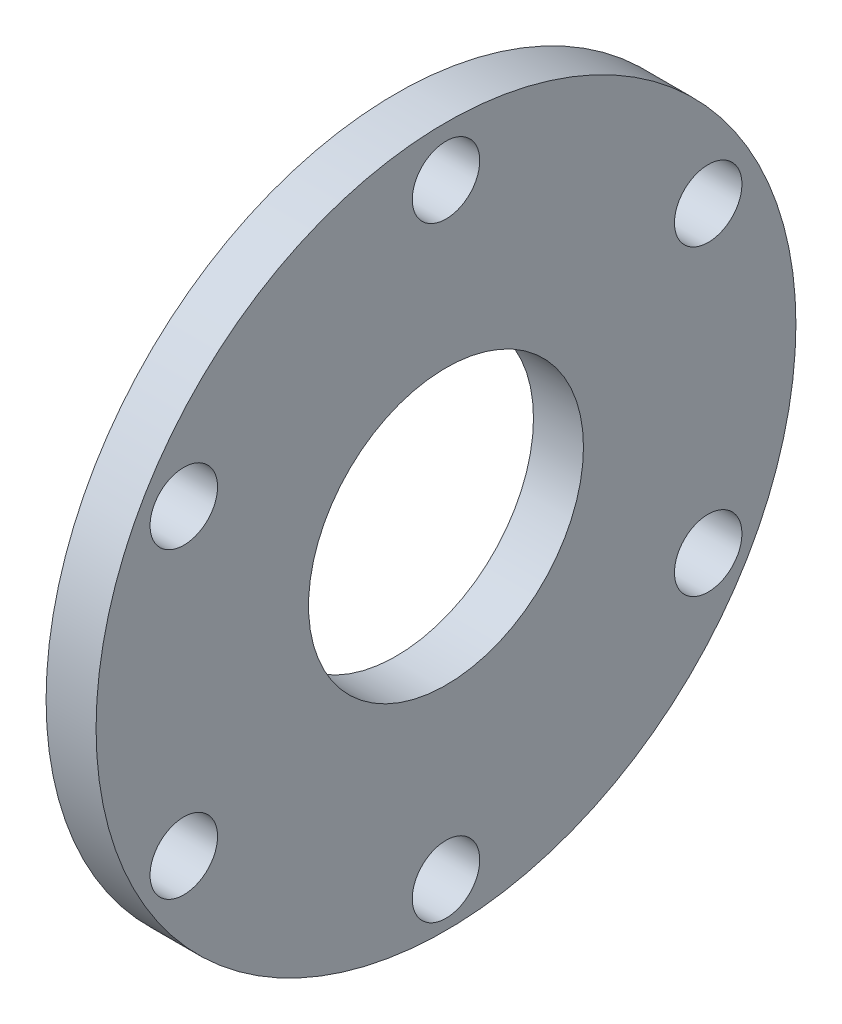
from build123d import *

# Parameters (mm, degrees)
CROQUIS1_R              = 70
SALIENTE_EXTRUIR1_DEPTH = 10
MATRIZC5_COUNT          = 6
CROQUIS9_R              = 27.5
CORTAR_EXTRUIR1_DEPTH   = 10


with BuildPart() as part:
    # Croquis1 → Saliente-Extruir1 (new body)
    with BuildSketch(Plane(origin=(0, 0, 0), x_dir=(0, 0, -1), z_dir=(1, 0, 0))):
        Circle(CROQUIS1_R)
    extrude(amount=SALIENTE_EXTRUIR1_DEPTH)

    # Croquis8 → Taladro de margen para M122 (revolve, cut)
    with BuildSketch(Plane(origin=(10, 60, 0), x_dir=(0, 0, -1), z_dir=(0, 1, 0))):
        Polygon((0, 0), (0, 47.555809178), (6.75, 43.5), (6.75, 0), align=None)
    taladro_de_margen_para_m122 = revolve(axis=Axis((16.35, 60, 0), (-1, 0, 0)), mode=Mode.SUBTRACT)

    # MatrizC5: Taladro de margen para M122 ×6 about axis
    matrizc5_axis = Axis((0, -0.563144546, 0), (1, 0, 0))
    for i in range(1, MATRIZC5_COUNT):
        add(taladro_de_margen_para_m122.rotate(matrizc5_axis, i * 360 / MATRIZC5_COUNT), mode=Mode.SUBTRACT)

    # Croquis9 → Cortar-Extruir1 (cut)
    with BuildSketch(Plane(origin=(10, 0, 0), x_dir=(0, 0, -1), z_dir=(1, 0, 0))):
        Circle(CROQUIS9_R)
    extrude(amount=-CORTAR_EXTRUIR1_DEPTH, mode=Mode.SUBTRACT)


solid = part.part
